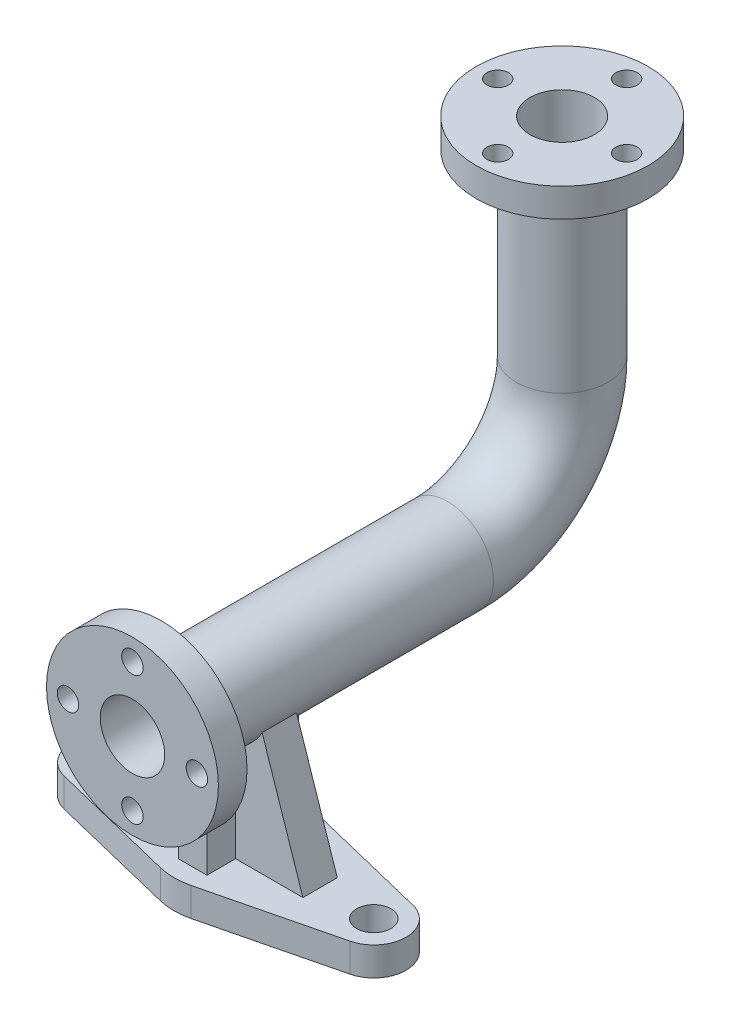
from build123d import *
from build123d.topology import SkipClean

# Parameters (mm, degrees)
SKETCH1_R           = 32
SKETCH1_R_2         = 22.5
SKETCH3_R           = 60
SKETCH3_R_2         = 22.5
BOSS_EXTRUDE1_DEPTH = 20
BOSS_EXTRUDE2_START = 20
SKETCH4_R           = 60
SKETCH4_R_2         = 22.5
BOSS_EXTRUDE2_DEPTH = 20
HOLE1_D             = 15
HOLE1_DEPTH         = 20
CIRPATTERN1_COUNT   = 4
HOLE2_D             = 15
HOLE2_DEPTH         = 20
CIRPATTERN2_COUNT   = 4
SKETCH12_R          = 12
BOSS_EXTRUDE3_DEPTH = 20
BOSS_EXTRUDE4_DEPTH = 12
SKETCH21_W          = 64
SKETCH21_H          = 81.283369249
BOSS_EXTRUDE5_DEPTH = 10


with BuildPart() as part:
    # Sweep1: sweep along a path in Sketch2
    with BuildLine(Plane(origin=(0, 0, 0), x_dir=(0, 0, -1), z_dir=(1, 0, 0))) as sweep1_path:
        Line((0, 0), (200, 0))
        ThreePointArc((200, 0), (256.568542495, 23.431457505), (280, 80))
        Line((280, 80), (280, 205))
    # Sketch1 → Sweep1 (sweep)
    with BuildSketch(Plane.XY):
        Circle(SKETCH1_R)
        Circle(SKETCH1_R_2, mode=Mode.SUBTRACT)
    sweep(path=sweep1_path.line)

    # Sketch3 → Boss-Extrude1 (add)
    with SkipClean():  # the faces are left unmerged after this step: merging them gives an invalid solid
        with BuildSketch(Plane.XY):
            Circle(SKETCH3_R)
            with Locations(Location((0, 0, 0), (0, 0, 270))):
                Circle(SKETCH3_R_2, mode=Mode.SUBTRACT)
        extrude(amount=BOSS_EXTRUDE1_DEPTH)

    # Sketch4 → Boss-Extrude2 (add)
    with SkipClean():  # the faces are left unmerged after this step: merging them gives an invalid solid
        with BuildSketch(Plane(origin=(0, 205, 0), x_dir=(1, 0, 0), z_dir=(0, 1, 0)).offset(BOSS_EXTRUDE2_START)):
            with Locations(Location((0, 280, 0), (0, 0, 270))):
                Circle(SKETCH4_R)
            with Locations(Location((0, 280, 0), (0, 0, 270))):
                Circle(SKETCH4_R_2, mode=Mode.SUBTRACT)
        extrude(amount=-BOSS_EXTRUDE2_DEPTH)

    # Hole1
    with Locations(Plane.XY.offset(20)):
        with Locations((45, 0)):
            hole1 = Hole(HOLE1_D / 2, depth=HOLE1_DEPTH)

    # CirPattern1: Hole1 ×4 about axis
    with SkipClean():  # the faces are left unmerged after this step: merging them gives an invalid solid
        cirpattern1_axis = Axis((0, 0, 0), (0, 0, 1))
        for i in range(1, CIRPATTERN1_COUNT):
            add(hole1.rotate(cirpattern1_axis, i * 360 / CIRPATTERN1_COUNT), mode=Mode.SUBTRACT)

    # Hole2
    with Locations(Plane(origin=(0, 225, 0), x_dir=(1, 0, 0), z_dir=(0, 1, 0))):
        with Locations((0, 235)):
            hole2 = Hole(HOLE2_D / 2, depth=HOLE2_DEPTH)

    # CirPattern2: Hole2 ×4 about axis
    with SkipClean():  # the faces are left unmerged after this step: merging them gives an invalid solid
        cirpattern2_axis = Axis((0, 0, -280), (0, 1, 0))
        for i in range(1, CIRPATTERN2_COUNT):
            add(hole2.rotate(cirpattern2_axis, i * 360 / CIRPATTERN2_COUNT), mode=Mode.SUBTRACT)



with BuildPart() as body_2:
    # Sketch12 → Boss-Extrude3 (new body)
    with BuildSketch(Plane(origin=(0, -120, 0), x_dir=(1, 0, 0), z_dir=(0, 1, 0))):
        with BuildLine():
            Line((10.714285714, 97.705881545), (99.857142857, 75.852940773))
            ThreePointArc((99.857142857, 75.852940773), (117, 54), (99.857142857, 32.147059227))
            Line((99.857142857, 32.147059227), (10.714285714, 10.294118455))
            ThreePointArc((10.714285714, 10.294118455), (0, 9), (-10.714285714, 10.294118455))
            Line((-10.714285714, 10.294118455), (-99.857142857, 32.147059227))
            ThreePointArc((-99.857142857, 32.147059227), (-117, 54), (-99.857142857, 75.852940773))
            Line((-99.857142857, 75.852940773), (-10.714285714, 97.705881545))
            ThreePointArc((-10.714285714, 97.705881545), (0, 99), (10.714285714, 97.705881545))
        make_face()
        with Locations(Location((-94.5, 54, 0), (0, 0, 270))):
            Circle(SKETCH12_R, mode=Mode.SUBTRACT)
        with Locations(Location((94.5, 54, 0), (0, 0, 270))):
            Circle(SKETCH12_R, mode=Mode.SUBTRACT)
    extrude(amount=BOSS_EXTRUDE3_DEPTH)


with BuildPart() as part_1:
    with SkipClean():  # the faces are left unmerged after this step: merging them gives an invalid solid
        add(part.part)

        add(body_2.part)  # Boss-Extrude4 merges body 2
        # Sketch19 → Boss-Extrude4 (add, symmetric)
        with BuildSketch(Plane.XY.offset(-54)):
            with BuildLine():
                Line((21.348386826, 7.106080491), (57, -100))
                Line((57, -100), (-57, -100))
                Line((-57, -100), (-21.348386826, 7.106080491))
                ThreePointArc((-21.348386826, 7.106080491), (0, -22.5), (21.348386826, 7.106080491))
            make_face()
        extrude(amount=BOSS_EXTRUDE4_DEPTH, both=True)

    # Sketch21 → Boss-Extrude5 (add, symmetric)
    with SkipClean():  # the faces are left unmerged after this step: merging them gives an invalid solid
        with BuildSketch(Plane(origin=(0, 0, 0), x_dir=(0, 0, -1), z_dir=(1, 0, 0))):
            with Locations((54, -65.842294917)):
                Rectangle(SKETCH21_W, SKETCH21_H)
        extrude(amount=BOSS_EXTRUDE5_DEPTH, both=True)


solid = part_1.part
